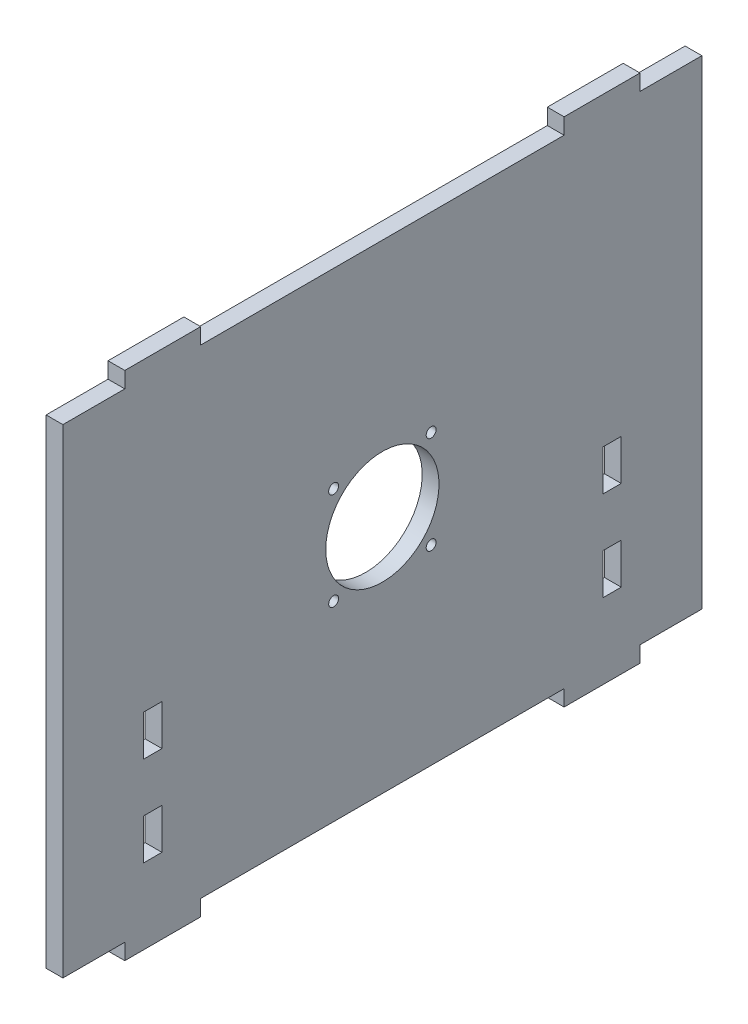
from build123d import *

# Parameters (mm, degrees)
SKETCH1_W               = 203.2
SKETCH1_H               = 152.4
BOSS_EXTRUDE2_DEPTH     = 5.334
SKETCH2_R               = 18
SKETCH2_R_2             = 1.575
CUT_EXTRUDE1_DEPTH      = 184.239656068
SKETCH3_W               = 24.13
SKETCH3_H               = 5.08
BOSS_EXTRUDE3_DEPTH     = 5.334
SKETCH4_W               = 5.842
SKETCH4_H               = 12.954
CUT_EXTRUDE2_DEPTH      = 184.239656068
MIRROR3_COPY_1_SKETCH_W = 24.13
MIRROR3_COPY_1_SKETCH_H = 5.08
MIRROR3_COPY_1_DEPTH    = 5.334


with BuildPart() as part:
    # Sketch1 → Boss-Extrude2 (new body)
    with BuildSketch(Plane(origin=(0, 0, 0), x_dir=(0, 0, -1), z_dir=(1, 0, 0))):
        with Locations((0, 76.2)):
            Rectangle(SKETCH1_W, SKETCH1_H)
    extrude(amount=BOSS_EXTRUDE2_DEPTH)

    # Sketch2 → Cut-Extrude1 (cut, through all)
    with BuildSketch(Plane.ZY):
        with Locations((0, 76.2)):
            Circle(SKETCH2_R)
        with Locations((-15.5, 91.7)):
            Circle(SKETCH2_R_2)
        with Locations((15.5, 91.7)):
            Circle(SKETCH2_R_2)
        with Locations((15.5, 60.7)):
            Circle(SKETCH2_R_2)
        with Locations((-15.5, 60.7)):
            Circle(SKETCH2_R_2)
    extrude(amount=-CUT_EXTRUDE1_DEPTH, mode=Mode.SUBTRACT)

    # Sketch3 → Boss-Extrude3 (add, through all)
    with BuildSketch(Plane(origin=(5.334, 0, 0), x_dir=(0, 0, -1), z_dir=(1, 0, 0))):
        with Locations((69.85, -2.54)):
            Rectangle(SKETCH3_W, SKETCH3_H)
    boss_extrude3 = extrude(amount=-BOSS_EXTRUDE3_DEPTH)

    # Mirror1: Boss-Extrude3 across plane
    add(boss_extrude3.mirror(Plane.XY))

    # Sketch4 → Cut-Extrude2 (cut, through all)
    with BuildSketch(Plane(origin=(5.334, 0, 0), x_dir=(0, 0, -1), z_dir=(1, 0, 0))):
        with Locations((73.025, 25.3365)):
            Rectangle(SKETCH4_W, SKETCH4_H)
        with Locations((73.025, 53.9115)):
            Rectangle(SKETCH4_W, SKETCH4_H)
    cut_extrude2 = extrude(amount=-CUT_EXTRUDE2_DEPTH, mode=Mode.SUBTRACT)

    # Mirror2: Cut-Extrude2 across plane
    add(cut_extrude2.mirror(Plane.XY), mode=Mode.SUBTRACT)

    # Mirror3: Boss-Extrude3 across plane
    add(boss_extrude3.mirror(Plane(origin=(0, 76.2, 0), x_dir=(0, 0, 1), z_dir=(0, -1, 0))))

    # Mirror3 copy 1 sketch → Mirror3 copy 1 (add, through all)
    with BuildSketch(Plane(origin=(5.334, 152.4, 0), x_dir=(0, 0, 1), z_dir=(1, 0, 0))):
        with Locations((69.85, -2.54)):
            Rectangle(MIRROR3_COPY_1_SKETCH_W, MIRROR3_COPY_1_SKETCH_H)
    extrude(amount=-MIRROR3_COPY_1_DEPTH)


solid = part.part
